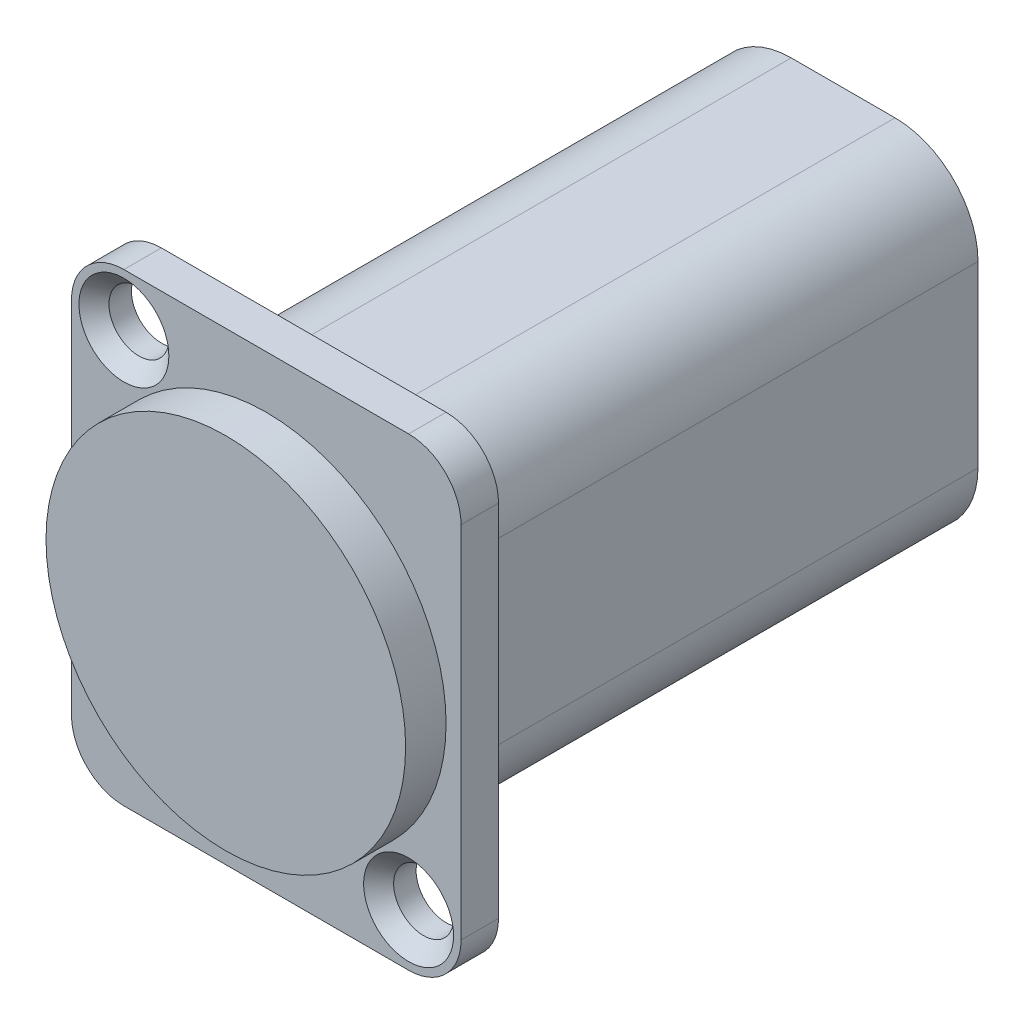
from build123d import *

# Parameters (mm, degrees)
SKETCH1_R           = 2
BOSS_EXTRUDE1_DEPTH = 1.25
BOSS_EXTRUDE2_START = 1.25
SKETCH1_3_R         = 12
BOSS_EXTRUDE2_DEPTH = 2.7
BOSS_EXTRUDE3_START = -1.25
BOSS_EXTRUDE3_DEPTH = 36
CHAMFER1_SIZE       = 1


with BuildPart() as part:
    # Sketch1 → Boss-Extrude1 (new, symmetric)
    with BuildSketch(Plane.XY):
        with BuildLine():
            Line((-9.5, -15.5), (9.5, -15.5))
            ThreePointArc((9.5, -15.5), (11.974873734, -14.474873734), (13, -12))
            Line((13, -12), (13, 12))
            ThreePointArc((13, 12), (11.974873734, 14.474873734), (9.5, 15.5))
            Line((9.5, 15.5), (-9.5, 15.5))
            ThreePointArc((-9.5, 15.5), (-11.974873734, 14.474873734), (-13, 12))
            Line((-13, 12), (-13, -12))
            ThreePointArc((-13, -12), (-11.974873734, -14.474873734), (-9.5, -15.5))
        make_face()
        with Locations((-9.5, 12)):
            Circle(SKETCH1_R, mode=Mode.SUBTRACT)
        with Locations((9.5, -12)):
            Circle(SKETCH1_R, mode=Mode.SUBTRACT)
    extrude(amount=BOSS_EXTRUDE1_DEPTH, both=True)

    # Sketch1<3> → Boss-Extrude2 (add)
    with BuildSketch(Plane.XY.offset(BOSS_EXTRUDE2_START)):
        with Locations(Location((0, 0, 0), (0, 0, 180))):
            Circle(SKETCH1_3_R)
    extrude(amount=BOSS_EXTRUDE2_DEPTH)

    # Sketch1<4> → Boss-Extrude3 (add)
    with BuildSketch(Plane.XY.offset(BOSS_EXTRUDE3_START)):
        with BuildLine():
            Line((-3.464466094, -11.5), (3.464466094, -11.5))
            ThreePointArc((3.464466094, -11.5), (7.378679656, -9.878679656), (9, -5.964466094))
            Line((9, -5.964466094), (9, 5.964466094))
            ThreePointArc((9, 5.964466094), (7.378679656, 9.878679656), (3.464466094, 11.5))
            Line((3.464466094, 11.5), (-3.464466094, 11.5))
            ThreePointArc((-3.464466094, 11.5), (-7.378679656, 9.878679656), (-9, 5.964466094))
            Line((-9, 5.964466094), (-9, -5.964466094))
            ThreePointArc((-9, -5.964466094), (-7.378679656, -9.878679656), (-3.464466094, -11.5))
        make_face()
    extrude(amount=-BOSS_EXTRUDE3_DEPTH)

    # Chamfer1
    chamfer1_edges = [part.edges().sort_by_distance(p)[0] for p in [
        (7.5, -12, 1.25),
        (-11.5, 12, 1.25),
    ]]
    chamfer(chamfer1_edges, length=CHAMFER1_SIZE)


solid = part.part
